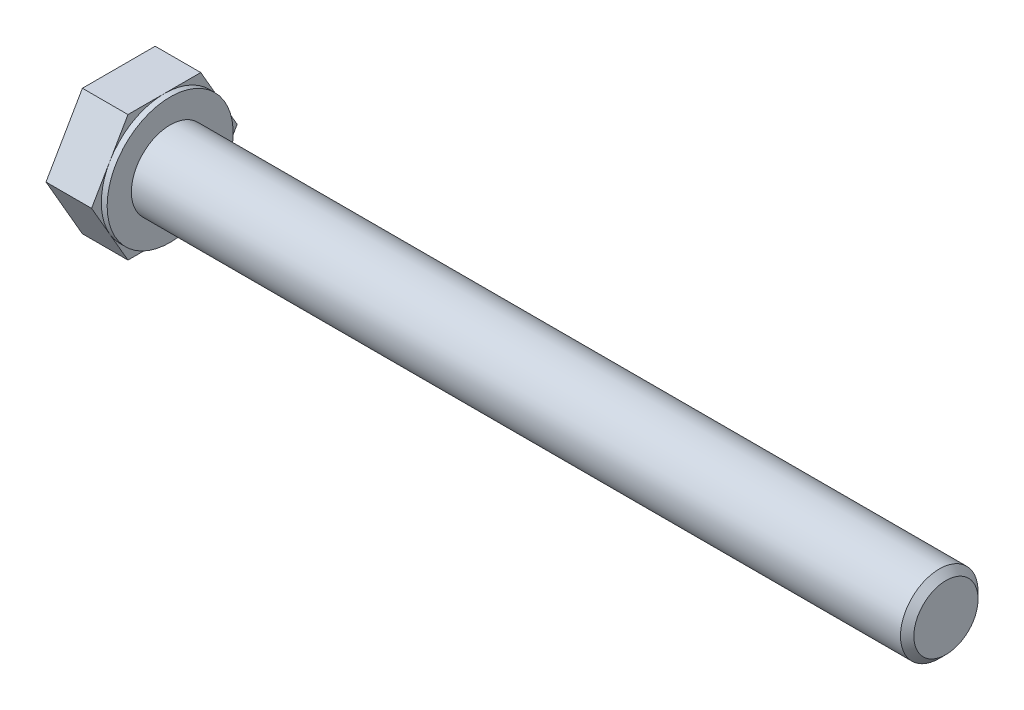
from build123d import *

# Parameters (mm, degrees)
HEX_2_DEPTH = 4.7


with BuildPart() as part:
    # BodySketch → BaseBody (revolve)
    with BuildSketch(Plane(origin=(0, 0, 0), x_dir=(1, 0, 0), z_dir=(0, 1, 0)), mode=Mode.PRIVATE) as basebody_sk:
        Polygon((79.3095, 4), (80, 3.3095), (80, 0), (-0.6, 0), (-0.6, 6.5), (0, 6.5), (0, 4), align=None)
    revolve(basebody_sk.sketch.rotate(Axis((0, 0, 0), (1, 0, 0)), 180), axis=Axis((0, 0, 0), (1, 0, 0)))

    # HeadSketch → Hex 2 (add)
    with BuildSketch(Plane.ZY.offset(0.6)):
        Polygon((7.505553499, 0), (3.75277675, 6.5), (-3.75277675, 6.5), (-7.505553499, 0), (-3.75277675, -6.5), (3.75277675, -6.5), align=None)
    extrude(amount=HEX_2_DEPTH)


solid = part.part
